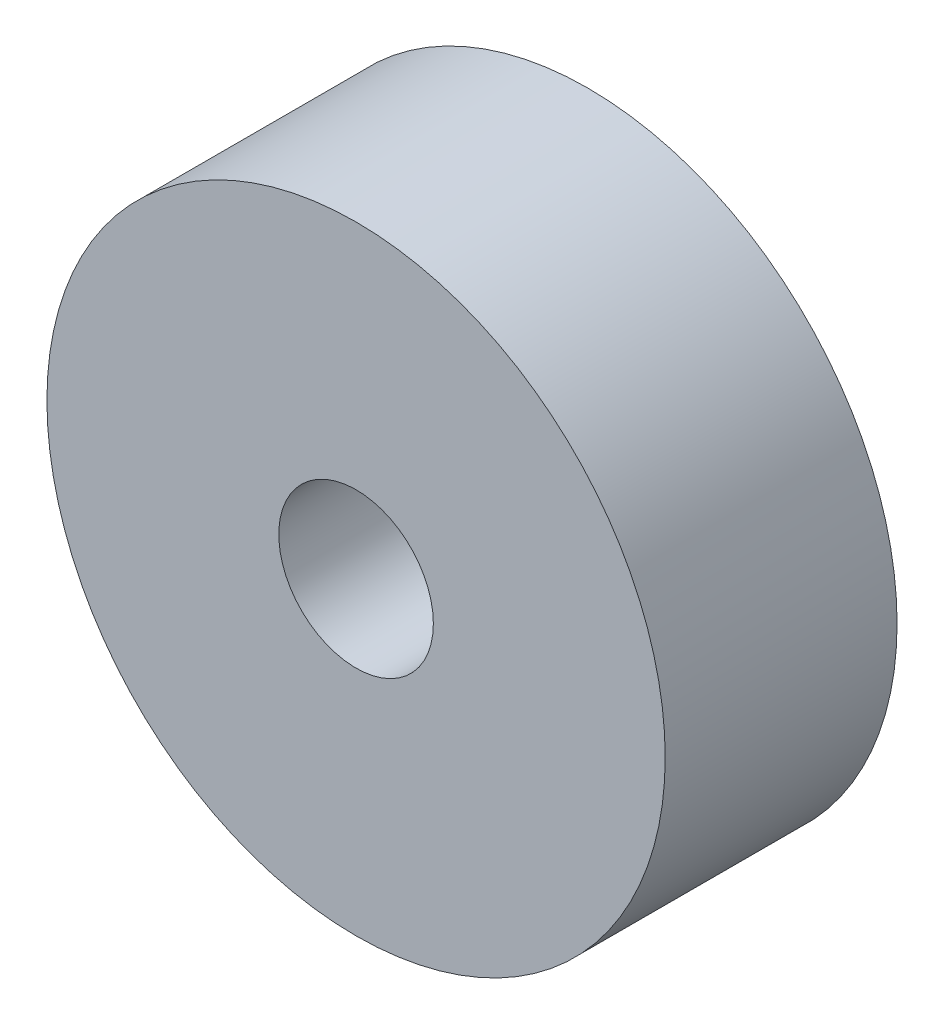
from build123d import *

# Parameters (mm, degrees)
SKETCH1_R           = 101.6
SKETCH1_R_2         = 25.4
BOSS_EXTRUDE2_DEPTH = 76.2


with BuildPart() as part:
    # Sketch1 → Boss-Extrude2 (new body)
    with BuildSketch(Plane.XY):
        Circle(SKETCH1_R)
        Circle(SKETCH1_R_2, mode=Mode.SUBTRACT)
    extrude(amount=-BOSS_EXTRUDE2_DEPTH)


solid = part.part
